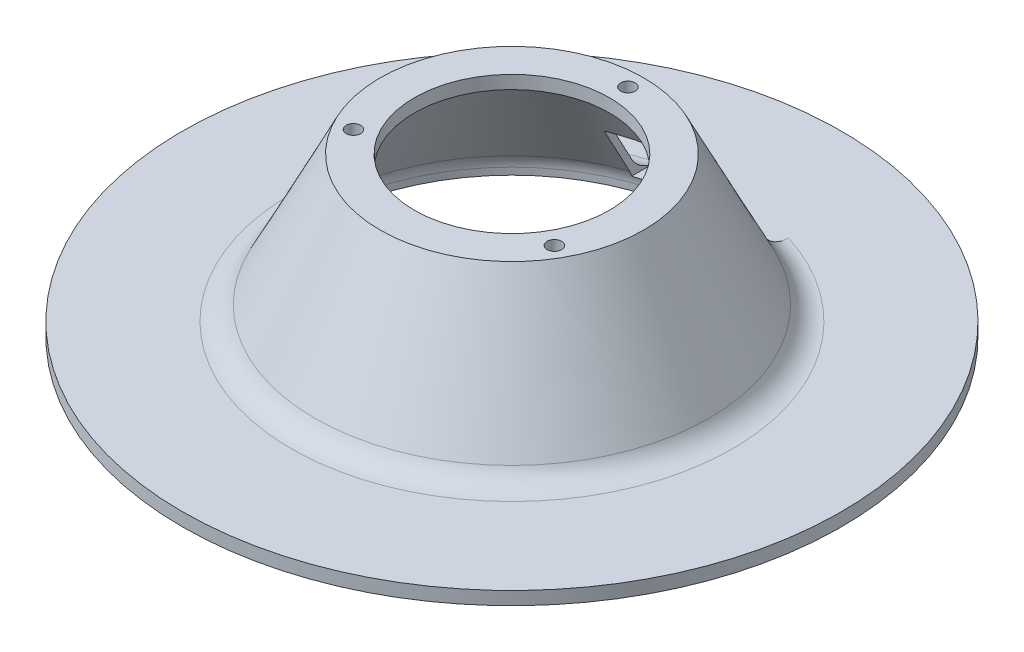
from build123d import *

# Parameters (mm, degrees)
SKETCH1_R           = 50
SKETCH1_R_2         = 2.75
SKETCH1_R_3         = 37
BOSS_EXTRUDE1_DEPTH = 5
SKETCH2_R           = 125
SKETCH2_R_2         = 75
BOSS_EXTRUDE2_DEPTH = 5
FILLET1_R           = 10
SKETCH4_W           = 50
SKETCH4_H           = 20
CUT_EXTRUDE1_DEPTH  = 186.135085845


with BuildPart() as part:
    # Sketch1 → Boss-Extrude1 (new body)
    with BuildSketch(Plane(origin=(0, 0, 0), x_dir=(1, 0, 0), z_dir=(0, 1, 0))):
        with Locations(Location((0, 0, 0), (0, 0, 270))):
            Circle(SKETCH1_R)
        with Locations(Location((0, 44, 0), (0, 0, 270))):
            Circle(SKETCH1_R_2, mode=Mode.SUBTRACT)
        with Locations(Location((38.105117767, -22, 0), (0, 0, 270))):
            Circle(SKETCH1_R_2, mode=Mode.SUBTRACT)
        with Locations(Location((-38.105117767, -22, 0), (0, 0, 270))):
            Circle(SKETCH1_R_2, mode=Mode.SUBTRACT)
        with Locations(Location((0, 0, 0), (0, 0, 270))):
            Circle(SKETCH1_R_3, mode=Mode.SUBTRACT)
    extrude(amount=BOSS_EXTRUDE1_DEPTH)



with BuildPart() as body_2:
    # Sketch2 → Boss-Extrude2 (new body)
    with BuildSketch(Plane(origin=(0, -55, 0), x_dir=(1, 0, 0), z_dir=(0, 1, 0))):
        with Locations(Location((0, 0, 0), (0, 0, 270))):
            Circle(SKETCH2_R)
        with Locations(Location((0, 0, 0), (0, 0, 270))):
            Circle(SKETCH2_R_2, mode=Mode.SUBTRACT)
    extrude(amount=BOSS_EXTRUDE2_DEPTH)


with BuildPart() as part_1:
    add(part.part)

    add(body_2.part)  # Revolve1 merges body 2
    # Sketch3 → Revolve1 (revolve)
    with BuildSketch(Plane.XY, mode=Mode.PRIVATE) as revolve1_sk:
        Polygon((-50, 0), (-75, -50), (-77.5, -50), (-50, 5), align=None)
    revolve(revolve1_sk.sketch.rotate(Axis((0, 0, 0), (0, -1, 0)), 270), axis=Axis((0, 0, 0), (0, -1, 0)))

    # Fillet1
    fillet1_edges = [part_1.edges().sort_by_distance(p)[0] for p in [
        (0, -50, -75),
        (0, -50, -77.5),
    ]]
    fillet(fillet1_edges, radius=FILLET1_R)

    # Sketch4 → Cut-Extrude1 (cut, through all)
    with BuildSketch(Plane.XY):
        with Locations((0, -40)):
            Rectangle(SKETCH4_W, SKETCH4_H)
    extrude(amount=-CUT_EXTRUDE1_DEPTH, mode=Mode.SUBTRACT)


solid = part_1.part
